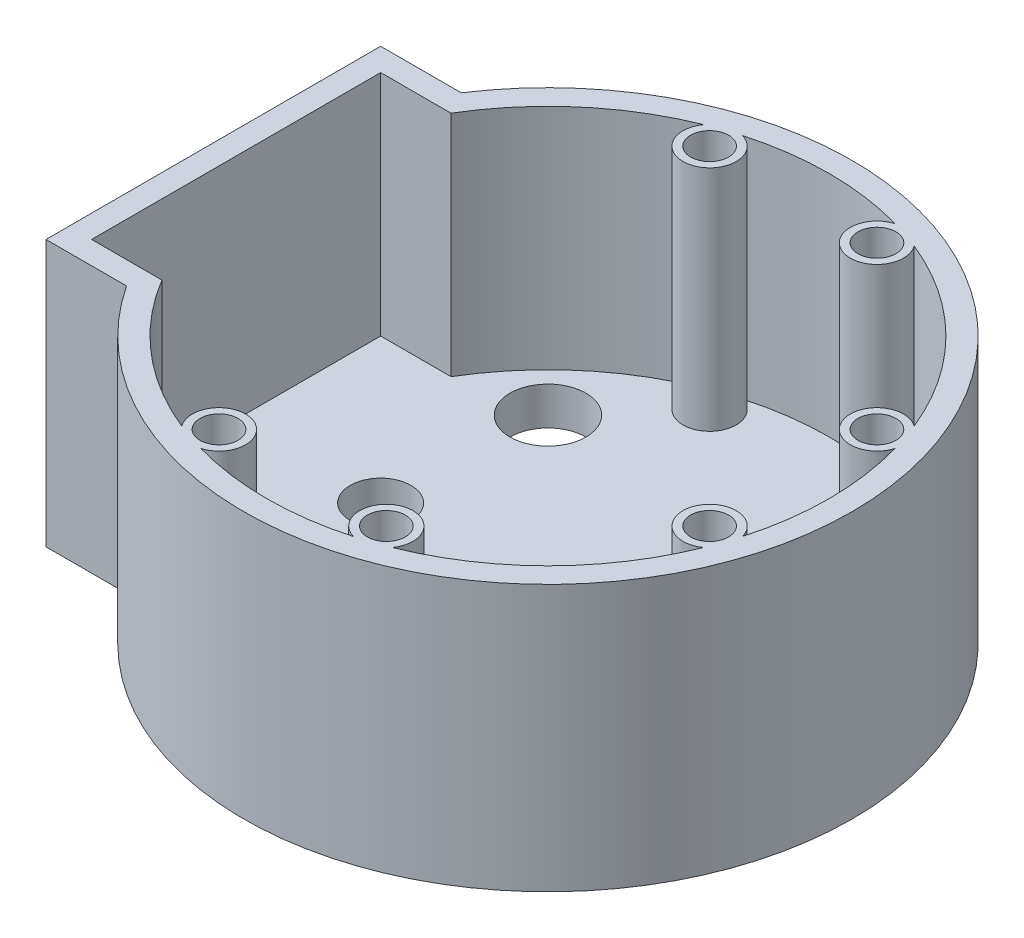
from build123d import *

# Parameters (mm, degrees)
BOSS_EXTRUDE5_DEPTH = 5
BOSS_EXTRUDE6_DEPTH = 30
SKETCH4_R           = 4
SKETCH4_R_2         = 5
CUT_EXTRUDE1_DEPTH  = 30
SKETCH5_R           = 2.5
CUT_EXTRUDE2_DEPTH  = 30
SKETCH6_R           = 2.5
BOSS_EXTRUDE8_DEPTH = 30


with BuildPart() as part:
    # Sketch1 → Boss-Extrude5 (new body)
    with BuildSketch(Plane(origin=(0, 0, 0), x_dir=(1, 0, 0), z_dir=(0, 1, 0))):
        with BuildLine():
            Line((-43.995148291, 21.997574146), (-43.995148291, 0))
            Line((-43.995148291, 0), (-43.995148291, -21.997574146))
            Line((-43.995148291, -21.997574146), (-33.402902563, -21.997574146))
            ThreePointArc((-33.402902563, -21.997574146), (39.989521092, 0), (-33.402902563, 21.997574146))
            Line((-33.402902563, 21.997574146), (-43.995148291, 21.997574146))
        make_face()
    extrude(amount=BOSS_EXTRUDE5_DEPTH)

    # Sketch3 → Boss-Extrude6 (add)
    with BuildSketch(Plane(origin=(0, 5, 0), x_dir=(1, 0, 0), z_dir=(0, 1, 0))):
        with BuildLine():
            Line((-43.995148291, -21.997574146), (-33.402902563, -21.997574146))
            ThreePointArc((-33.402902563, -21.997574146), (39.989521092, 0), (-33.402902563, 21.997574146))
            Line((-33.402902563, 21.997574146), (-43.995148291, 21.997574146))
            Line((-43.995148291, 21.997574146), (-43.995148291, -21.997574146))
        make_face()
        with BuildLine():
            Line((-41, 19.004191941), (-31.749015624, 19.004191941))
            ThreePointArc((-31.749015624, 19.004191941), (36.998253479, 0.000315282), (-31.75, -19))
            Line((-31.75, -19), (-41, -19))
            Line((-41, -19), (-41, 19.004191941))
        make_face(mode=Mode.SUBTRACT)
    extrude(amount=BOSS_EXTRUDE6_DEPTH)

    # Sketch4 → Cut-Extrude1 (cut)
    with BuildSketch(Plane(origin=(0, 5, 0), x_dir=(1, 0, 0), z_dir=(0, 1, 0))):
        with Locations(Location((-22, 0, 0), (0, 0, 270))):
            Circle(SKETCH4_R)
        with Locations(Location((-21, 21, 0), (0, 0, 270))):
            Circle(SKETCH4_R_2)
        with Locations(Location((21, 21, 0), (0, 0, 270))):
            Circle(SKETCH4_R_2)
        with Locations(Location((21, -21, 0), (0, 0, 270))):
            Circle(SKETCH4_R_2)
        with Locations(Location((-21, -21, 0), (0, 0, 270))):
            Circle(SKETCH4_R_2)
    extrude(amount=-CUT_EXTRUDE1_DEPTH, mode=Mode.SUBTRACT)

    # Sketch5 → Cut-Extrude2 (cut)
    with BuildSketch(Plane(origin=(0, 5, 0), x_dir=(1, 0, 0), z_dir=(0, 1, 0))):
        with Locations(Location((-11, 32.25, 0), (0, 0, 270))):
            Circle(SKETCH5_R)
        with Locations(Location((11, 32.25, 0), (0, 0, 270))):
            Circle(SKETCH5_R)
        with Locations(Location((32.25, -11, 0), (0, 0, 270))):
            Circle(SKETCH5_R)
        with Locations(Location((32.25, 11, 0), (0, 0, 270))):
            Circle(SKETCH5_R)
        with Locations(Location((11, -32.25, 0), (0, 0, 270))):
            Circle(SKETCH5_R)
        with Locations(Location((-11, -32.25, 0), (0, 0, 270))):
            Circle(SKETCH5_R)
    extrude(amount=-CUT_EXTRUDE2_DEPTH, mode=Mode.SUBTRACT)

    # Sketch6 → Boss-Extrude8 (add)
    # profile 1 of 6: a face of its own
    with BuildSketch(Plane(origin=(0, 5, 0), x_dir=(1, 0, 0), z_dir=(0, 1, 0))):
        with BuildLine():
            ThreePointArc((-13.818927057, 34.324524101), (-12.091731491, 28.92462448), (-7.5, 32.25))
            ThreePointArc((-7.5, 32.25), (-8.205027171, 34.356686233), (-10.036072506, 35.614646161))
            ThreePointArc((-10.036072506, 35.614646161), (-11.944932636, 35.020701186), (-13.818927057, 34.324524101))
        make_face()
        with Locations(Location((-11, 32.25, 0), (0, 0, 270))):
            Circle(SKETCH6_R, mode=Mode.SUBTRACT)
    # profile 2 of 6: a face of its own
    with BuildSketch(Plane(origin=(0, 5, 0), x_dir=(1, 0, 0), z_dir=(0, 1, 0))):
        with BuildLine():
            ThreePointArc((13.820396396, 34.322526036), (11.94483736, 35.019542221), (10.034341301, 35.614149711))
            ThreePointArc((10.034341301, 35.614149711), (8.894032936, 29.454485249), (14.5, 32.25))
            ThreePointArc((14.5, 32.25), (14.325762122, 33.340553212), (13.820396396, 34.322526036))
        make_face()
        with Locations(Location((11, 32.25, 0), (0, 0, 270))):
            Circle(SKETCH6_R, mode=Mode.SUBTRACT)
    # profile 3 of 6: a face of its own
    with BuildSketch(Plane(origin=(0, 5, 0), x_dir=(1, 0, 0), z_dir=(0, 1, 0))):
        with BuildLine():
            ThreePointArc((35.613053698, 10.030531162), (35.017865848, 11.943917844), (34.319964959, 13.822276575))
            ThreePointArc((34.319964959, 13.822276575), (28.937333966, 9.870290414), (35.613053698, 10.030531162))
        make_face()
        with Locations(Location((32.25, 11, 0), (0, 0, 270))):
            Circle(SKETCH6_R, mode=Mode.SUBTRACT)
    # profile 4 of 6: a face of its own
    with BuildSketch(Plane(origin=(0, 5, 0), x_dir=(1, 0, 0), z_dir=(0, 1, 0))):
        with BuildLine():
            ThreePointArc((34.318509264, -13.82334366), (35.017020802, -11.943848204), (35.612690699, -10.029272818))
            ThreePointArc((35.612690699, -10.029272818), (28.937413903, -9.870056041), (34.318509264, -13.82334366))
        make_face()
        with Locations(Location((32.25, -11, 0), (0, 0, 270))):
            Circle(SKETCH6_R, mode=Mode.SUBTRACT)
    # profile 5 of 6: a face of its own
    with BuildSketch(Plane(origin=(0, 5, 0), x_dir=(1, 0, 0), z_dir=(0, 1, 0))):
        with BuildLine():
            ThreePointArc((10.02986849, -35.612862598), (11.943992144, -35.017283262), (13.82305009, -34.318909904))
            ThreePointArc((13.82305009, -34.318909904), (14.326460229, -33.338421951), (14.5, -32.25))
            ThreePointArc((14.5, -32.25), (8.895892147, -29.453085603), (10.02986849, -35.612862598))
        make_face()
        with Locations(Location((11, -32.25, 0), (0, 0, 270))):
            Circle(SKETCH6_R, mode=Mode.SUBTRACT)
    # profile 6 of 6: a face of its own
    with BuildSketch(Plane(origin=(0, 5, 0), x_dir=(1, 0, 0), z_dir=(0, 1, 0))):
        with BuildLine():
            ThreePointArc((-13.821585883, -34.320906348), (-11.944087605, -35.018442073), (-10.031594901, -35.61336016))
            ThreePointArc((-10.031594901, -35.61336016), (-8.203625754, -34.354825664), (-7.5, -32.25))
            ThreePointArc((-7.5, -32.25), (-12.089598414, -28.923924941), (-13.821585883, -34.320906348))
        make_face()
        with Locations(Location((-11, -32.25, 0), (0, 0, 270))):
            Circle(SKETCH6_R, mode=Mode.SUBTRACT)
    extrude(amount=BOSS_EXTRUDE8_DEPTH)


solid = part.part
